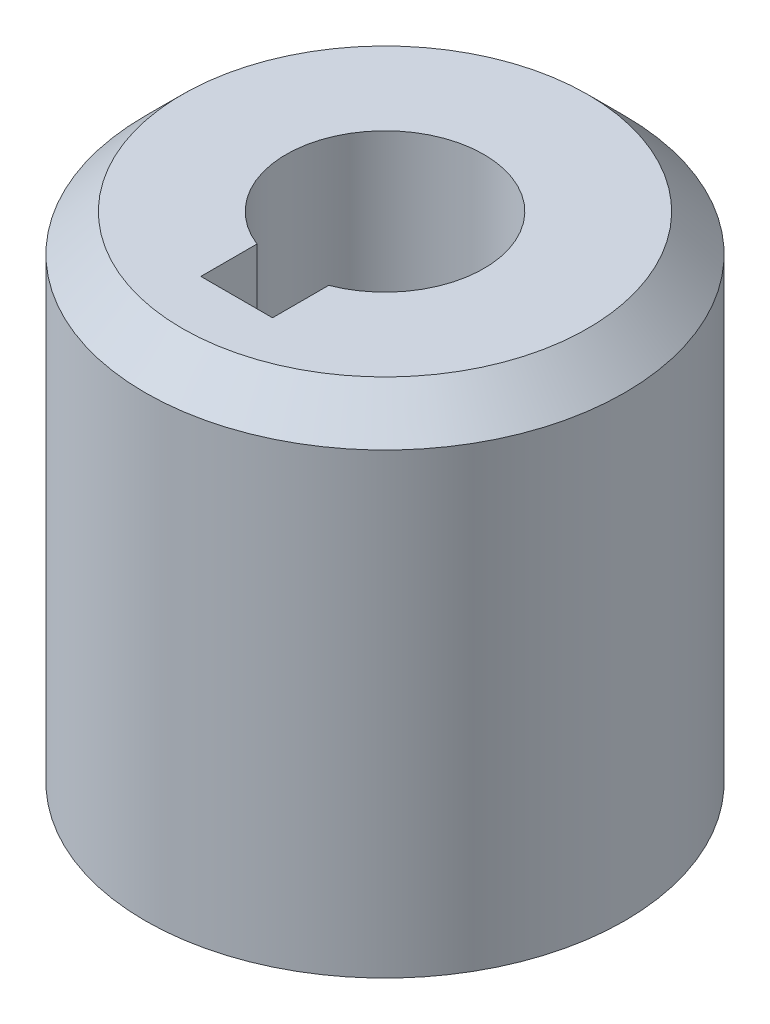
from build123d import *

# Parameters (mm, degrees)
SKETCH1_R           = 9.7
BOSS_EXTRUDE1_DEPTH = 20
CHAMFER1_SIZE       = 1.5


with BuildPart() as part:
    # Sketch1 → Boss-Extrude1 (new body)
    with BuildSketch(Plane(origin=(0, 0, 0), x_dir=(1, 0, 0), z_dir=(0, 1, 0))):
        with Locations(Location((0, 0, 0), (0, 0, 270))):
            Circle(SKETCH1_R)
        with BuildLine():
            Line((-1.45, -6), (1.45, -6))
            Line((1.45, -6), (1.45, -3.727935085))
            ThreePointArc((1.45, -3.727935085), (0, 4), (-1.45, -3.727935085))
            Line((-1.45, -3.727935085), (-1.45, -6))
        make_face(mode=Mode.SUBTRACT)
    extrude(amount=BOSS_EXTRUDE1_DEPTH)

    # Chamfer1
    chamfer1_edges = [part.edges().sort_by_distance(p)[0] for p in [
        (0, 20, -9.7),
    ]]
    chamfer(chamfer1_edges, length=CHAMFER1_SIZE)


solid = part.part
